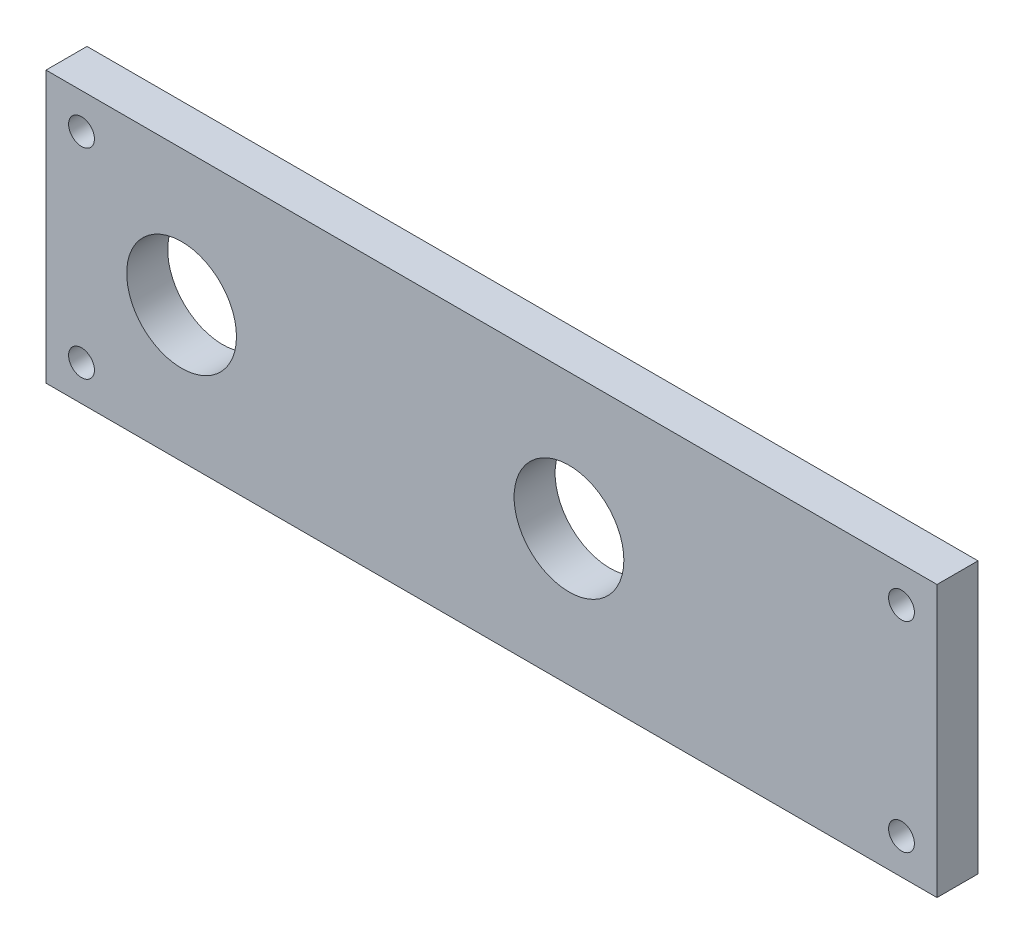
from build123d import *

# Parameters (mm, degrees)
SKETCH2_W           = 138
SKETCH2_H           = 42
SKETCH2_R           = 2
SKETCH2_R_2         = 8.5
BOSS_EXTRUDE1_DEPTH = 3.175


with BuildPart() as part:
    # Sketch2 → Boss-Extrude1 (new, symmetric)
    with BuildSketch(Plane.XY):
        with Locations((48, 0)):
            Rectangle(SKETCH2_W, SKETCH2_H)
        with Locations((-15.5, -15.5)):
            Circle(SKETCH2_R, mode=Mode.SUBTRACT)
        with Locations((-15.5, 15.5)):
            Circle(SKETCH2_R, mode=Mode.SUBTRACT)
        with Locations((111.5, 15.5)):
            Circle(SKETCH2_R, mode=Mode.SUBTRACT)
        with Locations((111.5, -15.5)):
            Circle(SKETCH2_R, mode=Mode.SUBTRACT)
        Circle(SKETCH2_R_2, mode=Mode.SUBTRACT)
        with Locations((60, 0)):
            Circle(SKETCH2_R_2, mode=Mode.SUBTRACT)
    extrude(amount=BOSS_EXTRUDE1_DEPTH, both=True)


solid = part.part
